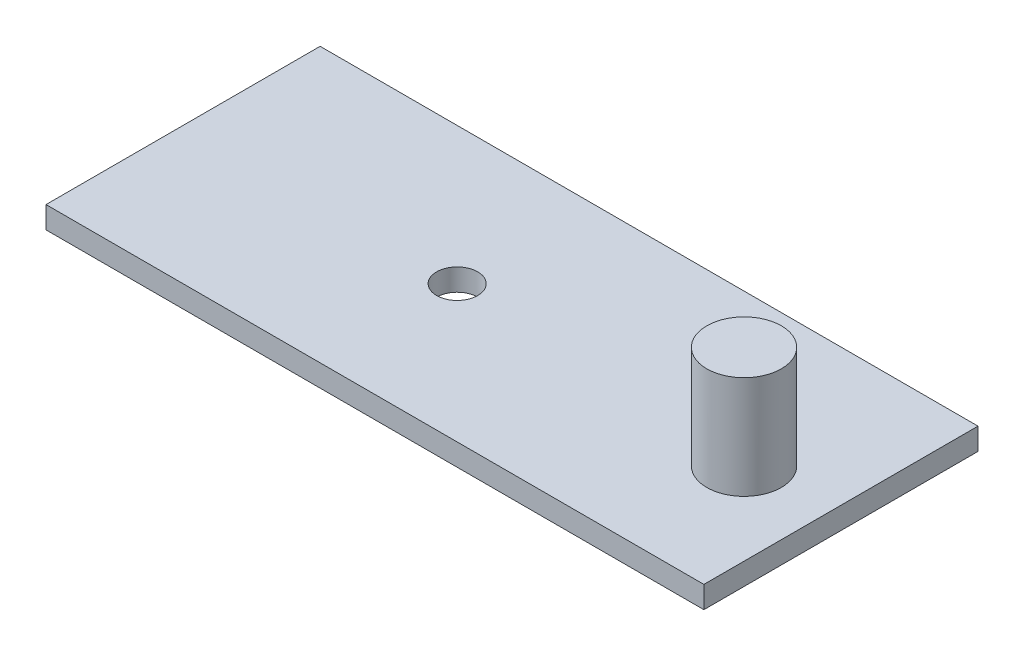
from build123d import *

# Parameters (mm, degrees)
SKETCH1_W           = 48
SKETCH1_H           = 20
SKETCH1_R           = 1.5
BOSS_EXTRUDE1_DEPTH = 1.6
SKETCH2_R           = 2.719189152
BOSS_EXTRUDE2_DEPTH = 7.5


with BuildPart() as part:
    # Sketch1 → Boss-Extrude1 (new body)
    with BuildSketch(Plane(origin=(0, 0, 0), x_dir=(1, 0, 0), z_dir=(0, 1, 0))):
        with Locations((24, 10)):
            Rectangle(SKETCH1_W, SKETCH1_H)
        with Locations(Location((20, 10, 0), (0, 0, 270))):
            Circle(SKETCH1_R, mode=Mode.SUBTRACT)
        with Locations(Location((38, 13.5, 0), (0, 0, 270))):
            Circle(SKETCH1_R, mode=Mode.SUBTRACT)
    extrude(amount=BOSS_EXTRUDE1_DEPTH)

    # Sketch2 → Boss-Extrude2 (add)
    with BuildSketch(Plane(origin=(0, 1.6, 0), x_dir=(1, 0, 0), z_dir=(0, 1, 0))):
        with Locations(Location((41.98482637, 8.947145481, 0), (0, 0, 90))):
            Circle(SKETCH2_R)
    extrude(amount=BOSS_EXTRUDE2_DEPTH)


solid = part.part
